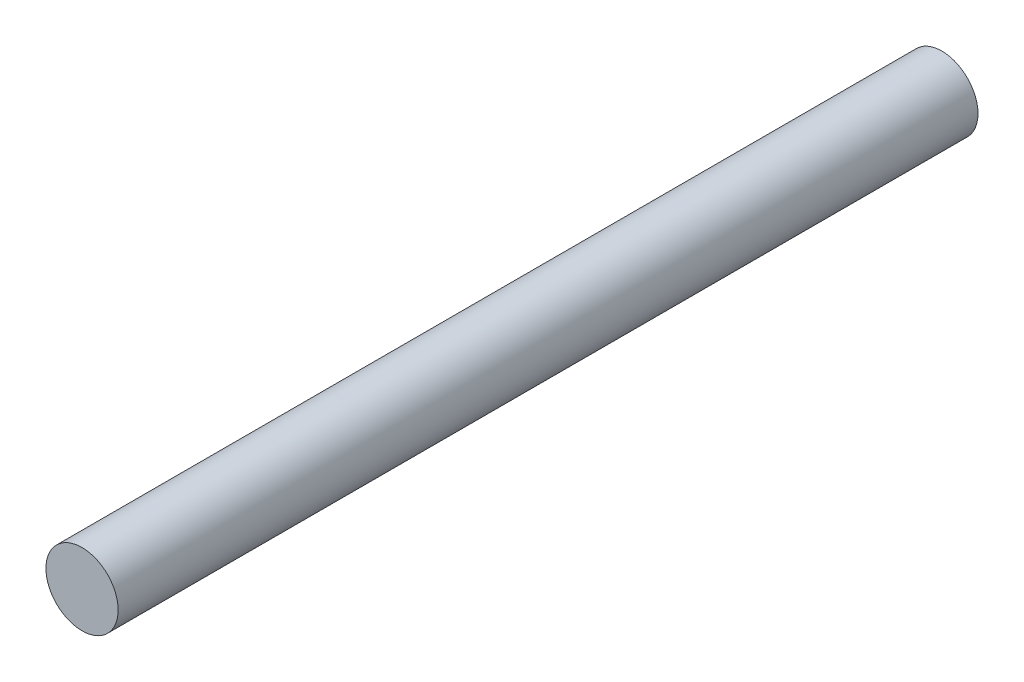
from build123d import *

# Parameters (mm, degrees)
SKETCH2_R           = 6.2
BOSS_EXTRUDE1_DEPTH = 147.7


with BuildPart() as part:
    # Sketch2 → Boss-Extrude1 (new body)
    with BuildSketch(Plane.XY):
        Circle(SKETCH2_R)
    extrude(amount=BOSS_EXTRUDE1_DEPTH)


solid = part.part
